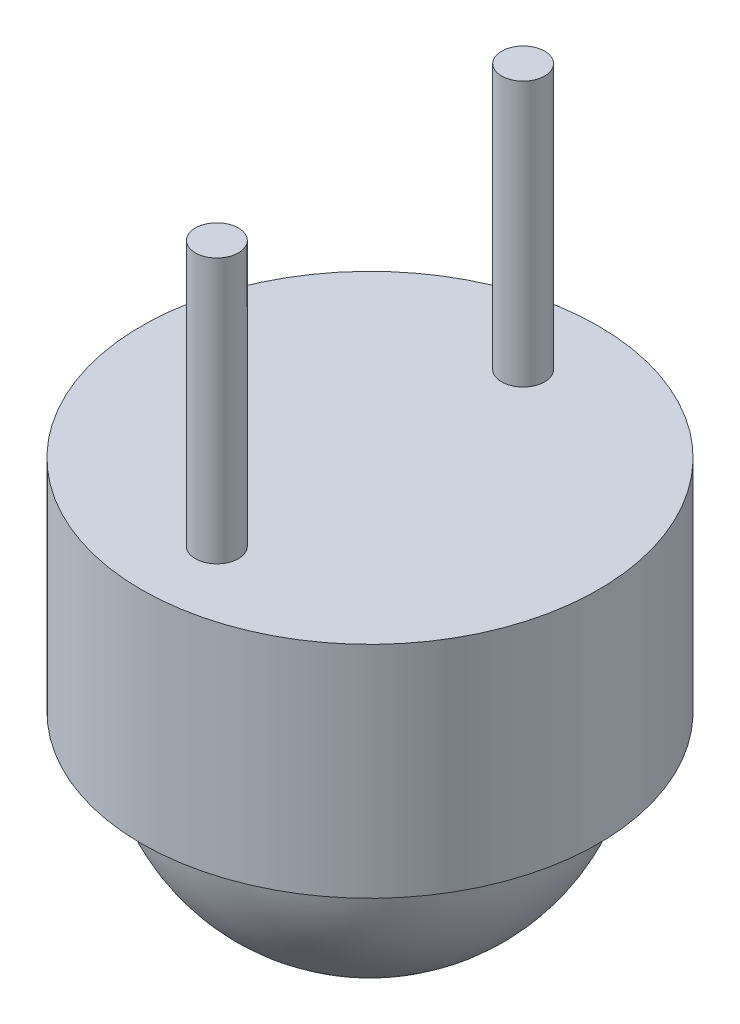
from build123d import *

# Parameters (mm, degrees)
SKETCH2_R          = 11.557
SKETCH2_R_2        = 9.525
HOUSING_PT_1_DEPTH = 9.525
SKETCH3_R          = 11.557
HOUSING_PT_2_DEPTH = 1.6
SKETCH4_R          = 1.09
SCREW_HOLES_DEPTH  = 1.6
SKETCH5_R          = 1.09
SCREWS_DEPTH       = 15
SCREWS_2_DEPTH     = 15


with BuildPart() as part:
    # Sketch1 → Metal Ball 3/4" (revolve)
    with BuildSketch(Plane.XY):
        with BuildLine():
            Line((0, -9.525), (0, 9.525))
            ThreePointArc((0, 9.525), (9.525, 0), (0, -9.525))
        make_face()
    revolve(axis=Axis((0, -9.525, 0), (0, 1, 0)))


with BuildPart() as body_2:
    # Sketch2 → Housing Pt. 1 (new body)
    with BuildSketch(Plane(origin=(0, 0, 0), x_dir=(1, 0, 0), z_dir=(0, 1, 0))):
        with Locations(Location((0, 0, 0), (0, 0, 90))):
            Circle(SKETCH2_R)
        with Locations(Location((0, 0, 0), (0, 0, 90))):
            Circle(SKETCH2_R_2, mode=Mode.SUBTRACT)
    extrude(amount=HOUSING_PT_1_DEPTH)

    # Sketch3 → Housing Pt. 2 (add)
    with BuildSketch(Plane(origin=(0, 9.525, 0), x_dir=(1, 0, 0), z_dir=(0, 1, 0))):
        with Locations(Location((0, 0, 0), (0, 0, 90))):
            Circle(SKETCH3_R)
    extrude(amount=HOUSING_PT_2_DEPTH)

    # Sketch4 → Screw Holes (cut)
    with BuildSketch(Plane(origin=(0, 11.125, 0), x_dir=(1, 0, 0), z_dir=(0, 1, 0))):
        with Locations(Location((0, 7.747, 0), (0, 0, 270))):
            Circle(SKETCH4_R)
        with Locations(Location((0, -7.747, 0), (0, 0, 270))):
            Circle(SKETCH4_R)
    extrude(amount=-SCREW_HOLES_DEPTH, mode=Mode.SUBTRACT)


with BuildPart() as body_3:
    # Sketch5 → Screws (new body)
    with BuildSketch(Plane.XZ.offset(-9.525)):
        with Locations(Location((0, 7.747, 0), (0, 0, 270))):
            Circle(SKETCH5_R)
    extrude(amount=-SCREWS_DEPTH)


with BuildPart() as body_4:
    # Sketch5 → Screws 2 (new body)
    with BuildSketch(Plane.XZ.offset(-9.525)):
        with Locations(Location((0, -7.747, 0), (0, 0, 270))):
            Circle(SKETCH5_R)
    extrude(amount=-SCREWS_2_DEPTH)


solid = Compound([part.part, body_2.part, body_3.part, body_4.part])
